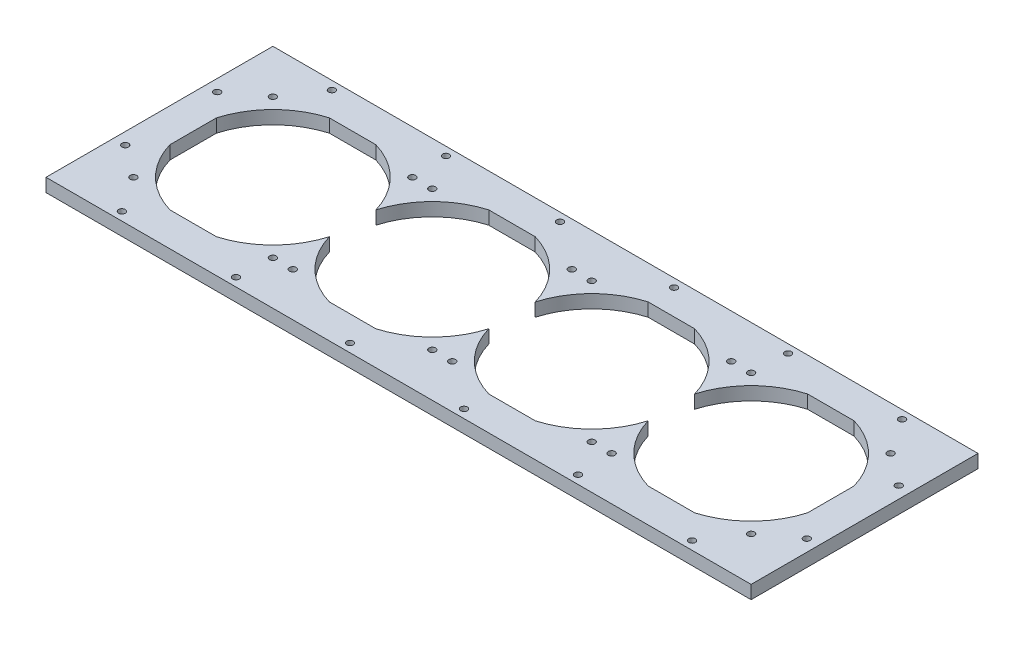
from build123d import *

# Parameters (mm, degrees)
SKETCH1_W           = 530.8
SKETCH1_H           = 170.8
SKETCH1_R           = 2.5
BOSS_EXTRUDE1_DEPTH = 10


with BuildPart() as part:
    # Sketch1 → Boss-Extrude1 (new body)
    with BuildSketch(Plane(origin=(0, 0, 0), x_dir=(1, 0, 0), z_dir=(0, 1, 0))):
        with Locations((223.844914973, 70.363620549)):
            Rectangle(SKETCH1_W, SKETCH1_H)
        with Locations(Location((-8.655085027, 17.863620549, 0), (0, 0, 270))):
            Circle(SKETCH1_R, mode=Mode.SUBTRACT)
        with Locations(Location((96.344914973, 17.863620549, 0), (0, 0, 90))):
            Circle(SKETCH1_R, mode=Mode.SUBTRACT)
        with Locations(Location((96.344914973, 122.863620549, 0), (0, 0, 270))):
            Circle(SKETCH1_R, mode=Mode.SUBTRACT)
        with Locations(Location((-8.655085027, 122.863620549, 0), (0, 0, 90))):
            Circle(SKETCH1_R, mode=Mode.SUBTRACT)
        with Locations(Location((111.344914973, 17.863620549, 0), (0, 0, 270))):
            Circle(SKETCH1_R, mode=Mode.SUBTRACT)
        with Locations(Location((216.344914973, 17.863620549, 0), (0, 0, 90))):
            Circle(SKETCH1_R, mode=Mode.SUBTRACT)
        with Locations(Location((111.344914973, 122.863620549, 0), (0, 0, 90))):
            Circle(SKETCH1_R, mode=Mode.SUBTRACT)
        with Locations(Location((216.344914973, 122.863620549, 0), (0, 0, 270))):
            Circle(SKETCH1_R, mode=Mode.SUBTRACT)
        with Locations(Location((231.344914973, 17.863620549, 0), (0, 0, 270))):
            Circle(SKETCH1_R, mode=Mode.SUBTRACT)
        with Locations(Location((336.344914973, 17.863620549, 0), (0, 0, 90))):
            Circle(SKETCH1_R, mode=Mode.SUBTRACT)
        with Locations(Location((231.344914973, 122.863620549, 0), (0, 0, 90))):
            Circle(SKETCH1_R, mode=Mode.SUBTRACT)
        with Locations(Location((336.344914973, 122.863620549, 0), (0, 0, 270))):
            Circle(SKETCH1_R, mode=Mode.SUBTRACT)
        with Locations(Location((351.344914973, 17.863620549, 0), (0, 0, 270))):
            Circle(SKETCH1_R, mode=Mode.SUBTRACT)
        with Locations(Location((456.344914973, 17.863620549, 0), (0, 0, 90))):
            Circle(SKETCH1_R, mode=Mode.SUBTRACT)
        with Locations(Location((351.344914973, 122.863620549, 0), (0, 0, 90))):
            Circle(SKETCH1_R, mode=Mode.SUBTRACT)
        with Locations(Location((456.344914973, 122.863620549, 0), (0, 0, 270))):
            Circle(SKETCH1_R, mode=Mode.SUBTRACT)
        with Locations(Location((9.244914973, 149.413620549, 0), (0, 0, 270))):
            Circle(SKETCH1_R, mode=Mode.SUBTRACT)
        with Locations(Location((95.084914973, 149.413620549, 0), (0, 0, 270))):
            Circle(SKETCH1_R, mode=Mode.SUBTRACT)
        with Locations(Location((180.924914973, 149.413620549, 0), (0, 0, 270))):
            Circle(SKETCH1_R, mode=Mode.SUBTRACT)
        with Locations(Location((266.764914973, 149.413620549, 0), (0, 0, 270))):
            Circle(SKETCH1_R, mode=Mode.SUBTRACT)
        with Locations(Location((352.604914973, 149.413620549, 0), (0, 0, 270))):
            Circle(SKETCH1_R, mode=Mode.SUBTRACT)
        with Locations(Location((438.444914973, 149.413620549, 0), (0, 0, 270))):
            Circle(SKETCH1_R, mode=Mode.SUBTRACT)
        with Locations(Location((480.384698099, 35.763620549, 0), (0, 0, 270))):
            Circle(SKETCH1_R, mode=Mode.SUBTRACT)
        with Locations(Location((438.444914973, -8.686379451, 0), (0, 0, 90))):
            Circle(SKETCH1_R, mode=Mode.SUBTRACT)
        with Locations(Location((352.604914973, -8.686379451, 0), (0, 0, 90))):
            Circle(SKETCH1_R, mode=Mode.SUBTRACT)
        with Locations(Location((266.764914973, -8.686379451, 0), (0, 0, 90))):
            Circle(SKETCH1_R, mode=Mode.SUBTRACT)
        with Locations(Location((180.924914973, -8.686379451, 0), (0, 0, 90))):
            Circle(SKETCH1_R, mode=Mode.SUBTRACT)
        with Locations(Location((95.084914973, -8.686379451, 0), (0, 0, 90))):
            Circle(SKETCH1_R, mode=Mode.SUBTRACT)
        with Locations(Location((9.244914973, -8.686379451, 0), (0, 0, 90))):
            Circle(SKETCH1_R, mode=Mode.SUBTRACT)
        with Locations(Location((480.384698099, 104.963620549, 0), (0, 0, 270))):
            Circle(SKETCH1_R, mode=Mode.SUBTRACT)
        with Locations(Location((-32.694868153, 35.763620549, 0), (0, 0, 90))):
            Circle(SKETCH1_R, mode=Mode.SUBTRACT)
        with Locations(Location((-32.694868153, 104.963620549, 0), (0, 0, 90))):
            Circle(SKETCH1_R, mode=Mode.SUBTRACT)
        with BuildLine():
            Line((146.344914973, 130.363620549), (181.344914973, 130.363620549))
            ThreePointArc((181.344914973, 130.363620549), (208.039088797, 114.557794374), (223.844914973, 87.863620549))
            ThreePointArc((223.844914973, 87.863620549), (239.650741149, 114.557794374), (266.344914973, 130.363620549))
            Line((266.344914973, 130.363620549), (301.344914973, 130.363620549))
            ThreePointArc((301.344914973, 130.363620549), (328.039088797, 114.557794374), (343.844914973, 87.863620549))
            ThreePointArc((343.844914973, 87.863620549), (359.650741149, 114.557794374), (386.344914973, 130.363620549))
            Line((386.344914973, 130.363620549), (421.344914973, 130.363620549))
            ThreePointArc((421.344914973, 130.363620549), (448.039088797, 114.557794374), (463.844914973, 87.863620549))
            Line((463.844914973, 87.863620549), (463.844914973, 52.863620549))
            ThreePointArc((463.844914973, 52.863620549), (448.039088797, 26.169446725), (421.344914973, 10.363620549))
            Line((421.344914973, 10.363620549), (386.344914973, 10.363620549))
            ThreePointArc((386.344914973, 10.363620549), (359.650741149, 26.169446725), (343.844914973, 52.863620549))
            ThreePointArc((343.844914973, 52.863620549), (328.039088797, 26.169446725), (301.344914973, 10.363620549))
            Line((301.344914973, 10.363620549), (266.344914973, 10.363620549))
            ThreePointArc((266.344914973, 10.363620549), (239.650741149, 26.169446725), (223.844914973, 52.863620549))
            ThreePointArc((223.844914973, 52.863620549), (208.039088797, 26.169446725), (181.344914973, 10.363620549))
            Line((181.344914973, 10.363620549), (146.344914973, 10.363620549))
            ThreePointArc((146.344914973, 10.363620549), (119.650741149, 26.169446725), (103.844914973, 52.863620549))
            ThreePointArc((103.844914973, 52.863620549), (88.039088797, 26.169446725), (61.344914973, 10.363620549))
            Line((61.344914973, 10.363620549), (26.344914973, 10.363620549))
            ThreePointArc((26.344914973, 10.363620549), (-0.349258851, 26.169446725), (-16.155085027, 52.863620549))
            Line((-16.155085027, 52.863620549), (-16.155085027, 87.863620549))
            ThreePointArc((-16.155085027, 87.863620549), (-0.349258851, 114.557794374), (26.344914973, 130.363620549))
            Line((26.344914973, 130.363620549), (61.344914973, 130.363620549))
            ThreePointArc((61.344914973, 130.363620549), (88.039088797, 114.557794374), (103.844914973, 87.863620549))
            ThreePointArc((103.844914973, 87.863620549), (119.650741149, 114.557794374), (146.344914973, 130.363620549))
        make_face(mode=Mode.SUBTRACT)
    extrude(amount=BOSS_EXTRUDE1_DEPTH)


solid = part.part
